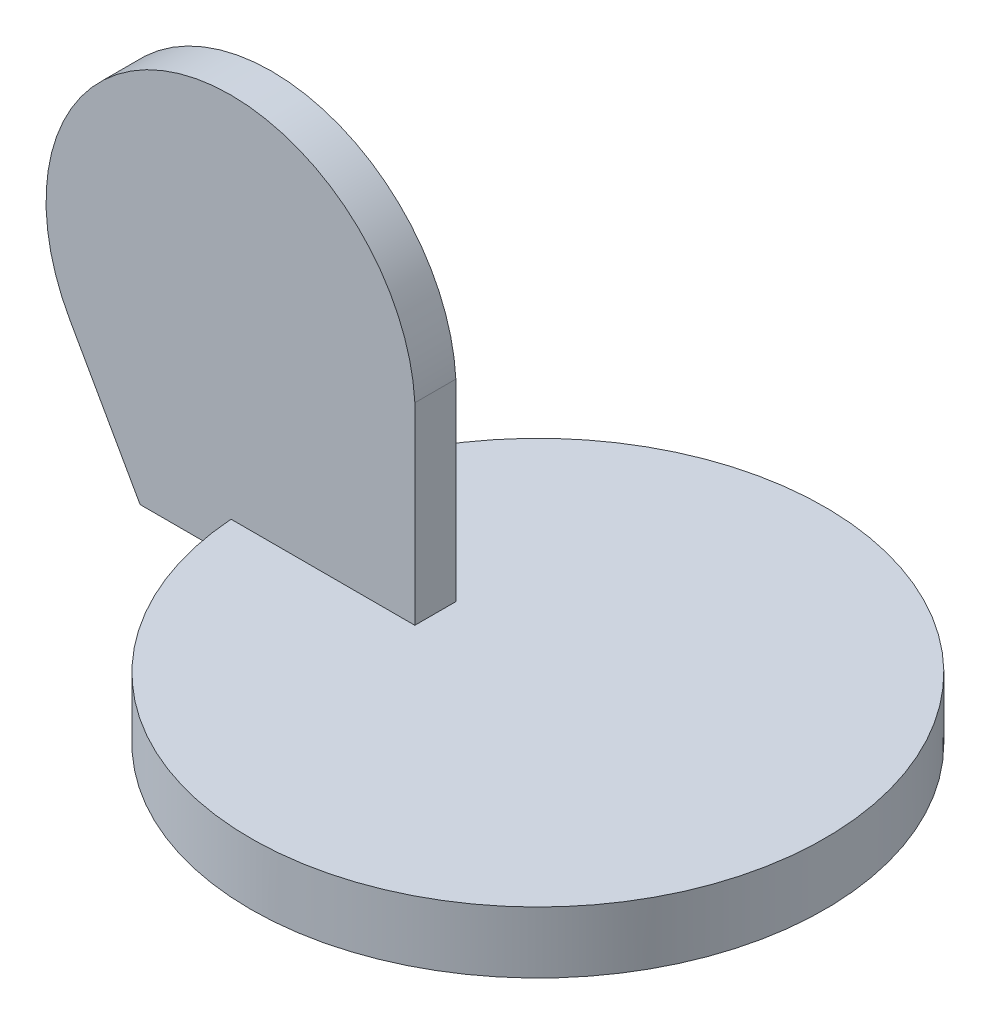
from build123d import *

# Parameters (mm, degrees)
SKETCH1_R           = 70
BOSS_EXTRUDE2_DEPTH = 15
SKETCH2_R           = 65
BOSS_EXTRUDE3_DEPTH = 3
BOSS_EXTRUDE4_DEPTH = 5


with BuildPart() as part:
    # Sketch1 → Boss-Extrude2 (new body)
    with BuildSketch(Plane(origin=(0, 0, 0), x_dir=(1, 0, 0), z_dir=(0, 1, 0))):
        with Locations(Location((0, 0, 0), (0, 0, 270))):
            Circle(SKETCH1_R)
    extrude(amount=BOSS_EXTRUDE2_DEPTH)

    # Sketch2 → Boss-Extrude3 (add)
    with BuildSketch(Plane.XZ):
        with Locations(Location((0, 0, 0), (0, 0, 270))):
            Circle(SKETCH2_R)
    extrude(amount=BOSS_EXTRUDE3_DEPTH)

    # Sketch3 → Boss-Extrude4 (add, symmetric)
    with BuildSketch(Plane.XY):
        with BuildLine():
            Line((-25, 62), (-25, 7))
            Line((-25, 7), (-92, 7))
            Line((-92, 7), (-109.156726544, 37.506503148))
            ThreePointArc((-109.156726544, 37.506503148), (-82.509371405, 102.772350464), (-25, 62))
        make_face()
    extrude(amount=BOSS_EXTRUDE4_DEPTH, both=True)


solid = part.part
